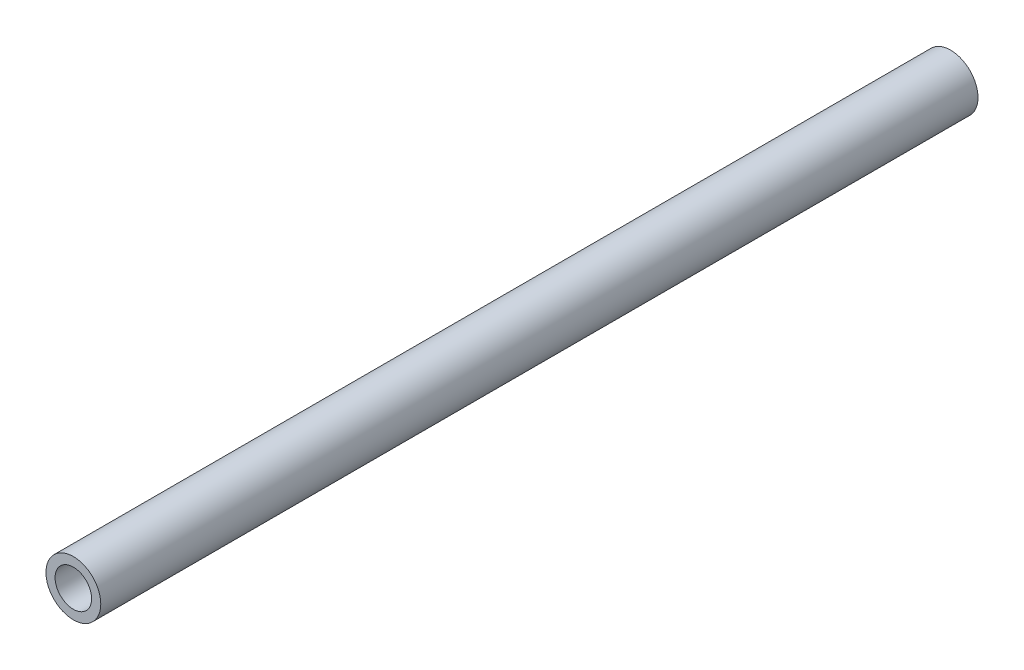
from build123d import *

# Parameters (mm, degrees)
SKETCH1_R           = 3
SKETCH1_R_2         = 2
BOSS_EXTRUDE1_DEPTH = 96


with BuildPart() as part:
    # Sketch1 → Boss-Extrude1 (new body)
    with BuildSketch(Plane.XY):
        Circle(SKETCH1_R)
        Circle(SKETCH1_R_2, mode=Mode.SUBTRACT)
    extrude(amount=BOSS_EXTRUDE1_DEPTH)


solid = part.part
